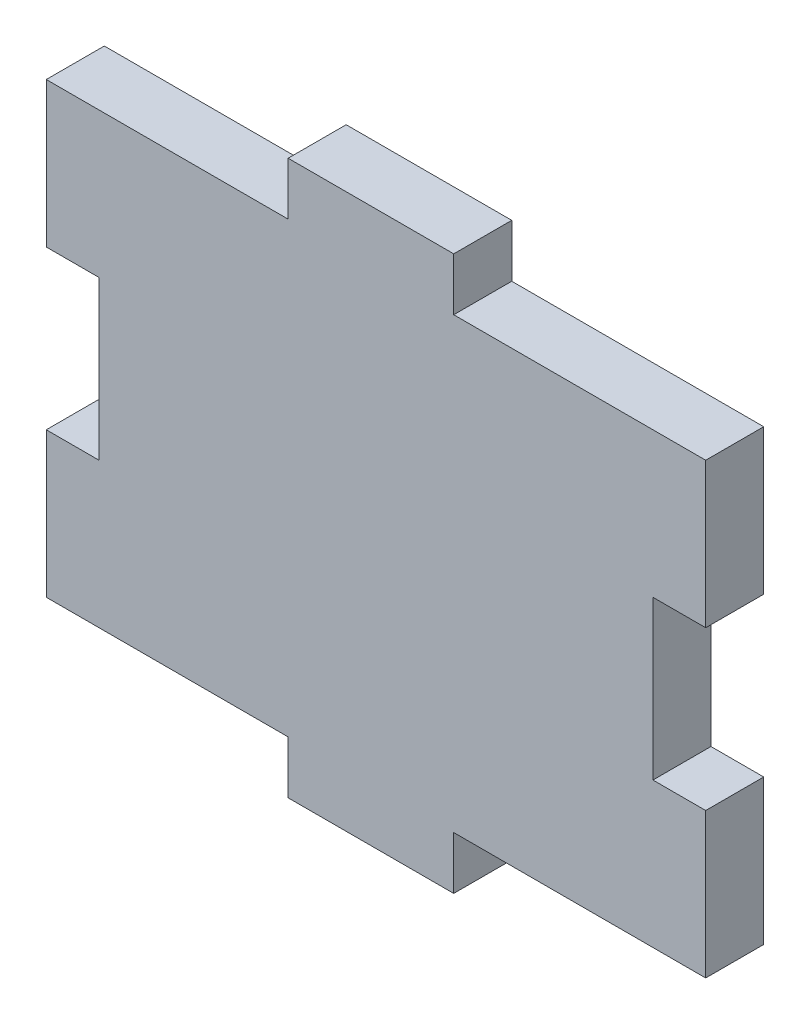
from build123d import *

# Parameters (mm, degrees)
SKETCH1_W           = 5.08
SKETCH1_H           = 13.97
SKETCH1_W_2         = 53.34
SKETCH1_H_2         = 43.18
SKETCH1_W_3         = 15.946260678
SKETCH1_H_3         = 5.08
BOSS_EXTRUDE1_DEPTH = 5.588


with BuildPart() as part:
    # Sketch1 → Boss-Extrude1 (new body)
    with BuildSketch(Plane.XY):
        with Locations((-29.21, 14.605)):
            Rectangle(SKETCH1_W, SKETCH1_H)
        Rectangle(SKETCH1_W_2, SKETCH1_H_2)
        with Locations((-0.487430597, 24.13)):
            Rectangle(SKETCH1_W_3, SKETCH1_H_3)
        with Locations((29.21, 14.605)):
            Rectangle(SKETCH1_W, SKETCH1_H)
        with Locations((-0.487430597, -24.13)):
            Rectangle(SKETCH1_W_3, SKETCH1_H_3)
        with Locations((-29.21, -14.605)):
            Rectangle(SKETCH1_W, SKETCH1_H)
        with Locations((29.21, -14.605)):
            Rectangle(SKETCH1_W, SKETCH1_H)
    extrude(amount=BOSS_EXTRUDE1_DEPTH)


solid = part.part
